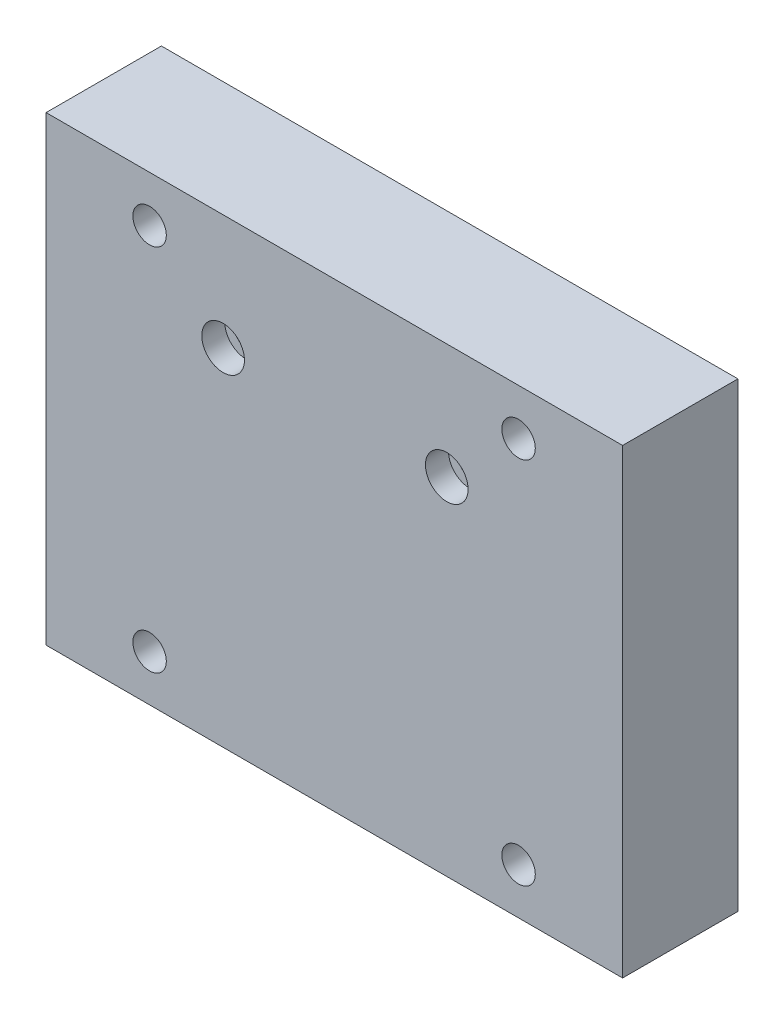
from build123d import *

# Parameters (mm, degrees)
SKETCH_1_W          = 50
SKETCH_1_H          = 40
EXTRUDE_1_DEPTH     = 10
SKETCH_2_R          = 1
CUT_EXTRUDE_1_DEPTH = 34.541019662
SKETCH_10_R         = 1.85
CUT_EXTRUDE_6_DEPTH = 2
SKETCH_11_W         = 26
SKETCH_11_H         = 6
CUT_EXTRUDE_7_DEPTH = 6.3
SKETCH_13_R         = 1.45
CUT_EXTRUDE_8_DEPTH = 10


with BuildPart() as part:
    # 草图1 → 凸台-拉伸1 (new body)
    with BuildSketch(Plane.XY):
        Rectangle(SKETCH_1_W, SKETCH_1_H)
    extrude(amount=EXTRUDE_1_DEPTH)

    # 草图2 → 切除-拉伸1 (cut, through all)
    with BuildSketch(Plane.XY.offset(10)):
        with Locations((-9.648315915, 10)):
            Circle(SKETCH_2_R)
        with Locations((9.751684085, 10)):
            Circle(SKETCH_2_R)
    extrude(amount=-CUT_EXTRUDE_1_DEPTH, mode=Mode.SUBTRACT)

    # 草图10 → 切除-拉伸6 (cut)
    with BuildSketch(Plane.XY.offset(10)):
        with Locations((-9.648315915, 10)):
            Circle(SKETCH_10_R)
        with Locations((9.751684085, 10)):
            Circle(SKETCH_10_R)
    extrude(amount=-CUT_EXTRUDE_6_DEPTH, mode=Mode.SUBTRACT)

    # 草图11 → 切除-拉伸7 (cut)
    with BuildSketch(Plane(origin=(0, 0, 0), x_dir=(-1, 0, 0), z_dir=(0, 0, -1))):
        with Locations((0, 10)):
            Rectangle(SKETCH_11_W, SKETCH_11_H)
    extrude(amount=-CUT_EXTRUDE_7_DEPTH, mode=Mode.SUBTRACT)

    # 草图13 → 切除-拉伸8 (cut)
    with BuildSketch(Plane.XY.offset(10)):
        with Locations((-16.023529812, 16)):
            Circle(SKETCH_13_R)
        with Locations((-16.023529812, -16)):
            Circle(SKETCH_13_R)
        with Locations((15.976470188, 16)):
            Circle(SKETCH_13_R)
        with Locations((15.976470188, -16)):
            Circle(SKETCH_13_R)
    extrude(amount=-CUT_EXTRUDE_8_DEPTH, mode=Mode.SUBTRACT)


solid = part.part
